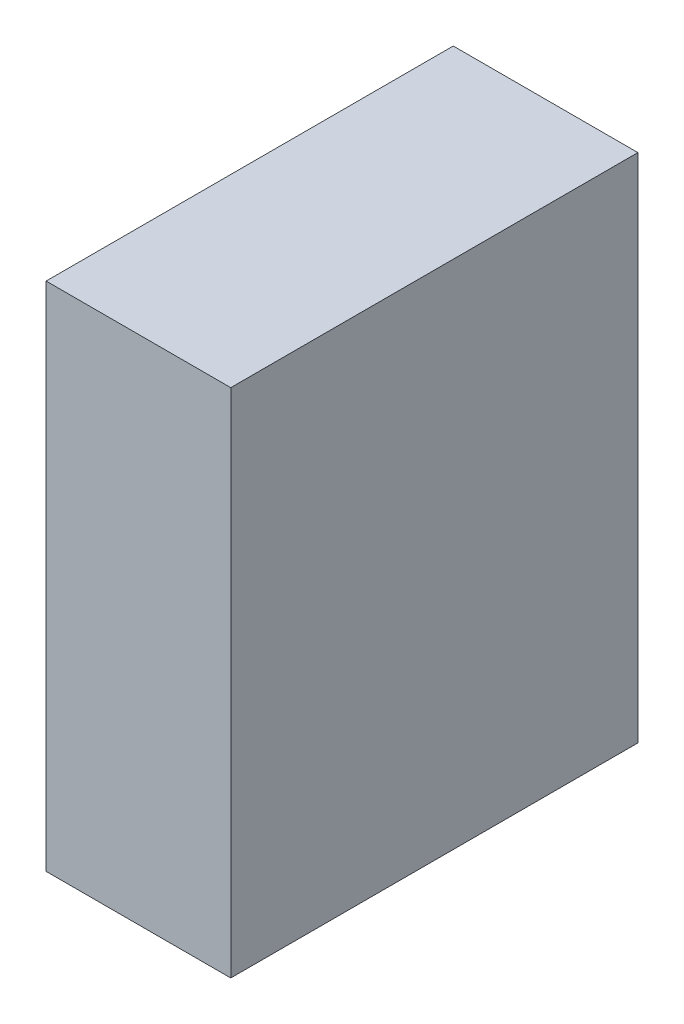
from build123d import *

# Parameters (mm, degrees)
SKETCH2_W           = 172
SKETCH2_H           = 216
BOSS_EXTRUDE1_DEPTH = 78


with BuildPart() as part:
    # Sketch2 → Boss-Extrude1 (new body)
    with BuildSketch(Plane(origin=(0, 0, 0), x_dir=(0, 0, -1), z_dir=(1, 0, 0))):
        with Locations((-328.802547771, -50.21656051)):
            Rectangle(SKETCH2_W, SKETCH2_H)
    extrude(amount=BOSS_EXTRUDE1_DEPTH)


solid = part.part
